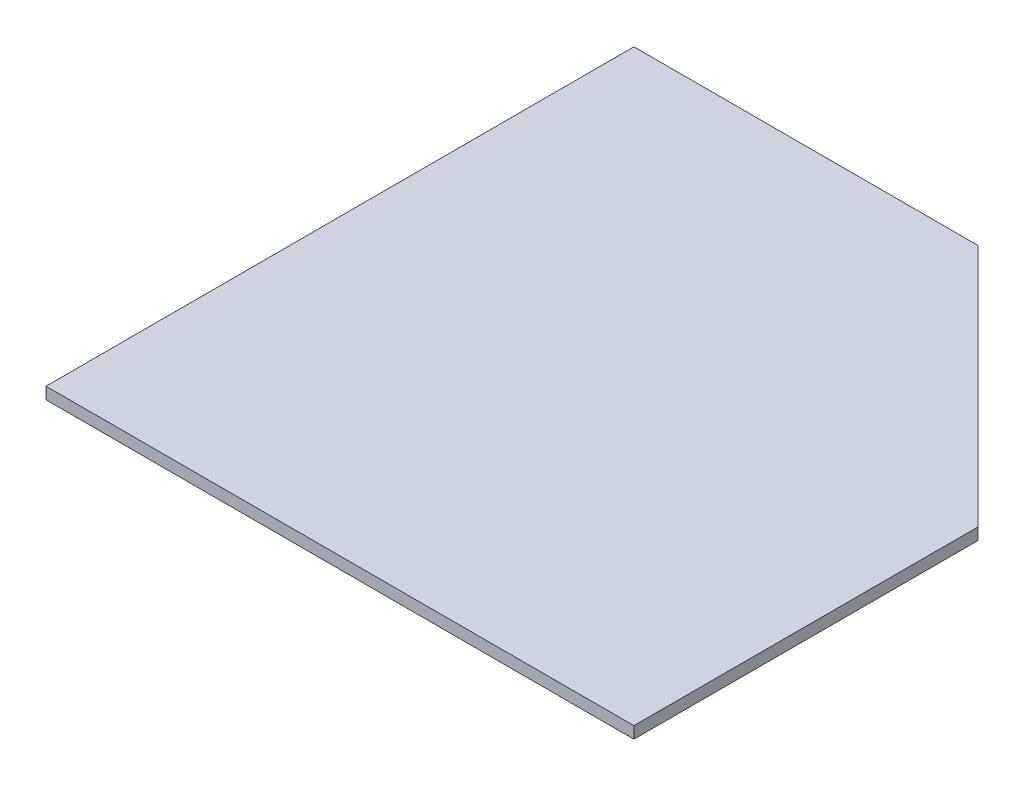
from build123d import *

# Parameters (mm, degrees)
SKETCH1_W               = 200
SKETCH1_H               = 200
BOSS_EXTRUDE1_DEPTH     = 4
CUT_EXTRUDE1_DEPTH      = 142.477913471
CUT_EXTRUDE1_DEPTH_BACK = 142.477913471


with BuildPart() as part:
    # Sketch1 → Boss-Extrude1 (new body)
    with BuildSketch(Plane(origin=(0, 0, 0), x_dir=(1, 0, 0), z_dir=(0, 1, 0))):
        Rectangle(SKETCH1_W, SKETCH1_H)
    extrude(amount=BOSS_EXTRUDE1_DEPTH)

    # Sketch2 → Cut-Extrude1 (cut, two sides: drawn at the far end of the back side and taken through both)
    with BuildSketch(Plane(origin=(0, 4, 0), x_dir=(1, 0, 0), z_dir=(0, 1, 0)).offset(-CUT_EXTRUDE1_DEPTH_BACK)):
        Polygon((726.729261237, -609.667248673), (207.718866814, -90.656854249), (-90.656854249, 207.718866814), (-609.667248673, 726.729261237), (428.353540174, 1764.750050084), (1764.750050084, 428.353540174), align=None)
    extrude(amount=CUT_EXTRUDE1_DEPTH + CUT_EXTRUDE1_DEPTH_BACK, mode=Mode.SUBTRACT)


solid = part.part
